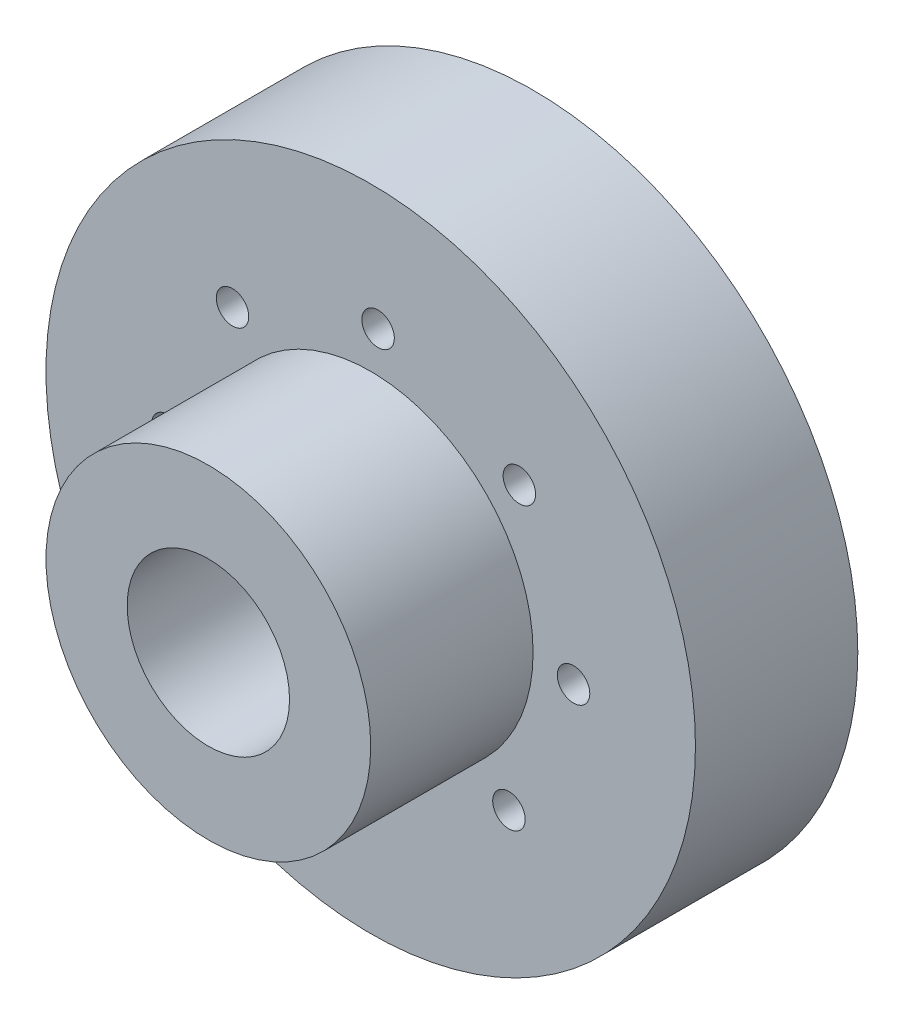
from build123d import *

# Parameters (mm, degrees)
SKETCH1_R           = 12.7
BOSS_EXTRUDE1_DEPTH = 12.7
SKETCH2_R           = 3.175
CUT_EXTRUDE1_DEPTH  = 22.997045256
SKETCH3_R           = 15.493591624
SKETCH3_R_2         = 6.35
CUT_EXTRUDE2_DEPTH  = 6.35
SKETCH4_R           = 0.635
CUT_EXTRUDE3_DEPTH  = 20.05


with BuildPart() as part:
    # Sketch1 → Boss-Extrude1 (new body)
    with BuildSketch(Plane.XY):
        Circle(SKETCH1_R)
    extrude(amount=BOSS_EXTRUDE1_DEPTH)

    # Sketch2 → Cut-Extrude1 (cut, through all)
    with BuildSketch(Plane.XY.offset(12.7)):
        Circle(SKETCH2_R)
    extrude(amount=-CUT_EXTRUDE1_DEPTH, mode=Mode.SUBTRACT)

    # Sketch3 → Cut-Extrude2 (cut)
    with BuildSketch(Plane.XY.offset(12.7)):
        Circle(SKETCH3_R)
        Circle(SKETCH3_R_2, mode=Mode.SUBTRACT)
    extrude(amount=-CUT_EXTRUDE2_DEPTH, mode=Mode.SUBTRACT)

    # Sketch4 → Cut-Extrude3 (cut, through all)
    with BuildSketch(Plane.XY.offset(6.35)):
        with Locations((0.288137957, 7.93226845)):
            Circle(SKETCH4_R)
        with Locations((5.812705114, 5.405216508)):
            Circle(SKETCH4_R)
        with Locations((7.93226845, -0.288137957)):
            Circle(SKETCH4_R)
        with Locations((5.405216508, -5.812705114)):
            Circle(SKETCH4_R)
        with Locations((-0.288137957, -7.93226845)):
            Circle(SKETCH4_R)
        with Locations((-5.812705114, -5.405216508)):
            Circle(SKETCH4_R)
        with Locations((-7.93226845, 0.288137957)):
            Circle(SKETCH4_R)
        with Locations((-5.405216508, 5.812705114)):
            Circle(SKETCH4_R)
    extrude(amount=-CUT_EXTRUDE3_DEPTH, mode=Mode.SUBTRACT)


solid = part.part
